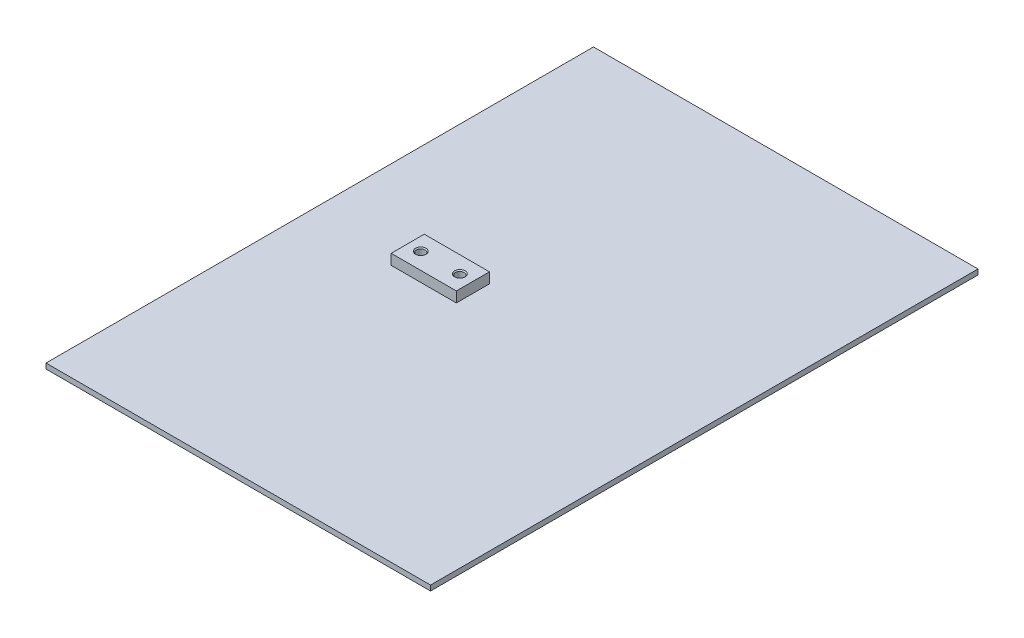
from build123d import *

# Parameters (mm, degrees)
SKETCH1_W                   = 147.5
SKETCH1_H                   = 210
BOSS_EXTRUDE1_DEPTH         = 2
SKETCH3_W                   = 25
SKETCH3_H                   = 12.7
BOSS_EXTRUDE3_DEPTH         = 4
M4_TAPPED_HOLE1_D           = 3.3
M4_TAPPED_HOLE1_CSINK_D     = 4.05
M4_TAPPED_HOLE1_CSINK_ANGLE = 90


with BuildPart() as part:
    # Sketch1 → Boss-Extrude1 (new body)
    with BuildSketch(Plane(origin=(0, 0, 0), x_dir=(1, 0, 0), z_dir=(0, 1, 0))):
        Rectangle(SKETCH1_W, SKETCH1_H)
    extrude(amount=BOSS_EXTRUDE1_DEPTH)

    # Sketch3 → Boss-Extrude3 (add)
    with BuildSketch(Plane(origin=(0, 2, 0), x_dir=(1, 0, 0), z_dir=(0, 1, 0))):
        with Locations((-27.5, 0)):
            Rectangle(SKETCH3_W, SKETCH3_H)
    extrude(amount=BOSS_EXTRUDE3_DEPTH)

    # M4 Tapped Hole1 (through all)
    with Locations(Plane(origin=(0, 6, 0), x_dir=(1, 0, 0), z_dir=(0, 1, 0))):
        with Locations((-20, 0), (-35, 0)):
            CounterSinkHole(M4_TAPPED_HOLE1_D / 2, M4_TAPPED_HOLE1_CSINK_D / 2, counter_sink_angle=M4_TAPPED_HOLE1_CSINK_ANGLE)


solid = part.part
